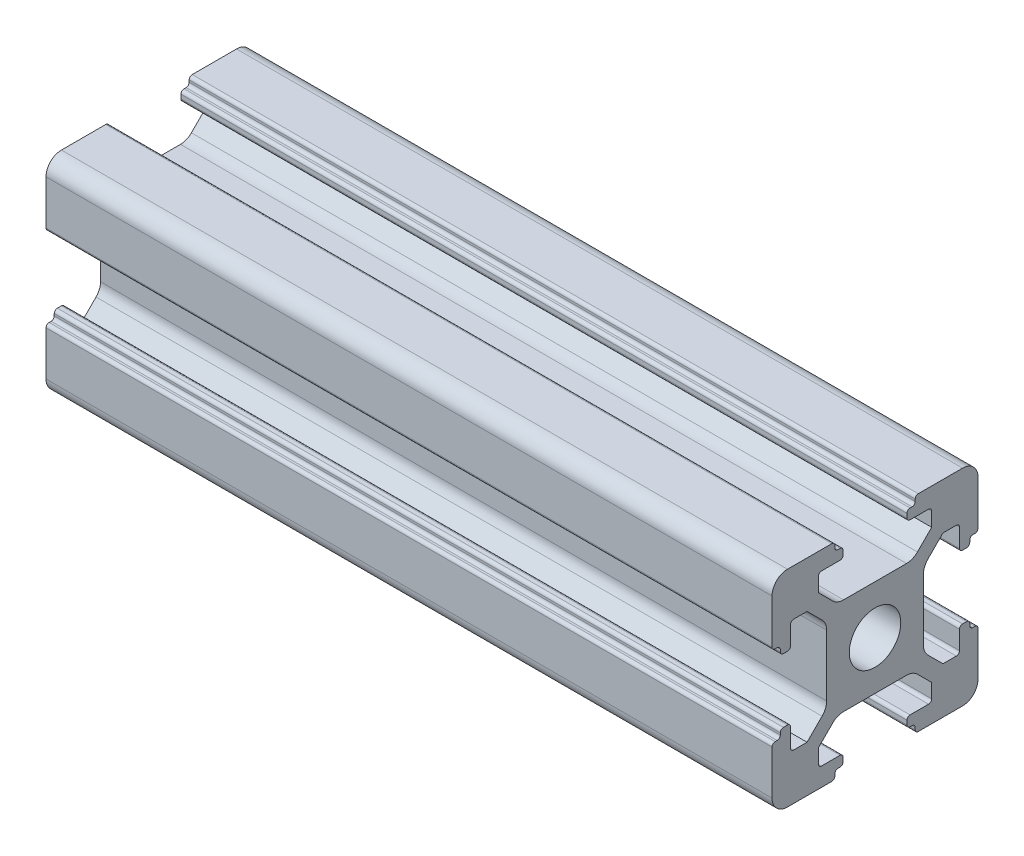
from build123d import *

# Parameters (mm, degrees)
SKETCH1_R           = 2.5
BOSS_EXTRUDE2_DEPTH = 35.25


with BuildPart() as part:
    # Sketch1 → Boss-Extrude2 (new, symmetric)
    with BuildSketch(Plane(origin=(0, 0, 0), x_dir=(0, 0, -1), z_dir=(1, 0, 0))):
        with BuildLine():
            Line((10, 4.2), (10, 8.5))
            ThreePointArc((10, 8.5), (9.560660172, 9.560660172), (8.5, 10))
            Line((8.5, 10), (4.2, 10))
            ThreePointArc((4.2, 10), (3.987867966, 9.912132034), (3.9, 9.7))
            Line((3.9, 9.7), (3.9, 9.5))
            ThreePointArc((3.9, 9.5), (3.812132034, 9.287867966), (3.6, 9.2))
            Line((3.6, 9.2), (3.4, 9.2))
            ThreePointArc((3.4, 9.2), (3.187867966, 9.112132034), (3.1, 8.9))
            Line((3.1, 8.9), (3.1, 8.5))
            ThreePointArc((3.1, 8.5), (3.187867966, 8.287867966), (3.4, 8.2))
            Line((3.4, 8.2), (5.2, 8.2))
            ThreePointArc((5.2, 8.2), (5.412132034, 8.112132034), (5.5, 7.9))
            Line((5.5, 7.9), (5.5, 6.521320344))
            Line((5.5, 6.521320344), (4.118019485, 5.139339828))
            ThreePointArc((4.118019485, 5.139339828), (3.631384461, 4.814180701), (3.057359313, 4.7))
            Line((3.057359313, 4.7), (-3.057359313, 4.7))
            ThreePointArc((-3.057359313, 4.7), (-3.631384461, 4.814180701), (-4.118019485, 5.139339828))
            Line((-4.118019485, 5.139339828), (-5.5, 6.521320344))
            Line((-5.5, 6.521320344), (-5.5, 7.9))
            ThreePointArc((-5.5, 7.9), (-5.412132034, 8.112132034), (-5.2, 8.2))
            Line((-5.2, 8.2), (-3.4, 8.2))
            ThreePointArc((-3.4, 8.2), (-3.187867966, 8.287867966), (-3.1, 8.5))
            Line((-3.1, 8.5), (-3.1, 8.9))
            ThreePointArc((-3.1, 8.9), (-3.187867966, 9.112132034), (-3.4, 9.2))
            Line((-3.4, 9.2), (-3.6, 9.2))
            ThreePointArc((-3.6, 9.2), (-3.812132034, 9.287867966), (-3.9, 9.5))
            Line((-3.9, 9.5), (-3.9, 9.7))
            ThreePointArc((-3.9, 9.7), (-3.987867966, 9.912132034), (-4.2, 10))
            Line((-4.2, 10), (-8.5, 10))
            ThreePointArc((-8.5, 10), (-9.560660172, 9.560660172), (-10, 8.5))
            Line((-10, 8.5), (-10, 4.2))
            ThreePointArc((-10, 4.2), (-9.912132034, 3.987867966), (-9.7, 3.9))
            Line((-9.7, 3.9), (-9.5, 3.9))
            ThreePointArc((-9.5, 3.9), (-9.287867966, 3.812132034), (-9.2, 3.6))
            Line((-9.2, 3.6), (-9.2, 3.4))
            ThreePointArc((-9.2, 3.4), (-9.112132034, 3.187867966), (-8.9, 3.1))
            Line((-8.9, 3.1), (-8.5, 3.1))
            ThreePointArc((-8.5, 3.1), (-8.287867966, 3.187867966), (-8.2, 3.4))
            Line((-8.2, 3.4), (-8.2, 5.2))
            ThreePointArc((-8.2, 5.2), (-8.112132034, 5.412132034), (-7.9, 5.5))
            Line((-7.9, 5.5), (-6.6, 5.5))
            Line((-6.6, 5.5), (-5.139339828, 4.039339828))
            ThreePointArc((-5.139339828, 4.039339828), (-4.814180701, 3.552704805), (-4.7, 2.978679656))
            Line((-4.7, 2.978679656), (-4.7, -2.978679656))
            ThreePointArc((-4.7, -2.978679656), (-4.814180701, -3.552704805), (-5.139339828, -4.039339828))
            Line((-5.139339828, -4.039339828), (-6.6, -5.5))
            Line((-6.6, -5.5), (-7.9, -5.5))
            ThreePointArc((-7.9, -5.5), (-8.112132034, -5.412132034), (-8.2, -5.2))
            Line((-8.2, -5.2), (-8.2, -3.4))
            ThreePointArc((-8.2, -3.4), (-8.287867966, -3.187867966), (-8.5, -3.1))
            Line((-8.5, -3.1), (-8.9, -3.1))
            ThreePointArc((-8.9, -3.1), (-9.112132034, -3.187867966), (-9.2, -3.4))
            Line((-9.2, -3.4), (-9.2, -3.6))
            ThreePointArc((-9.2, -3.6), (-9.287867966, -3.812132034), (-9.5, -3.9))
            Line((-9.5, -3.9), (-9.7, -3.9))
            ThreePointArc((-9.7, -3.9), (-9.912132034, -3.987867966), (-10, -4.2))
            Line((-10, -4.2), (-10, -8.5))
            ThreePointArc((-10, -8.5), (-9.560660172, -9.560660172), (-8.5, -10))
            Line((-8.5, -10), (-4.2, -10))
            ThreePointArc((-4.2, -10), (-3.987867966, -9.912132034), (-3.9, -9.7))
            Line((-3.9, -9.7), (-3.9, -9.5))
            ThreePointArc((-3.9, -9.5), (-3.812132034, -9.287867966), (-3.6, -9.2))
            Line((-3.6, -9.2), (-3.4, -9.2))
            ThreePointArc((-3.4, -9.2), (-3.187867966, -9.112132034), (-3.1, -8.9))
            Line((-3.1, -8.9), (-3.1, -8.5))
            ThreePointArc((-3.1, -8.5), (-3.187867966, -8.287867966), (-3.4, -8.2))
            Line((-3.4, -8.2), (-5.2, -8.2))
            ThreePointArc((-5.2, -8.2), (-5.412132034, -8.112132034), (-5.5, -7.9))
            Line((-5.5, -7.9), (-5.5, -6.521320344))
            Line((-5.5, -6.521320344), (-4.118019485, -5.139339828))
            ThreePointArc((-4.118019485, -5.139339828), (-3.631384461, -4.814180701), (-3.057359313, -4.7))
            Line((-3.057359313, -4.7), (3.057359313, -4.7))
            ThreePointArc((3.057359313, -4.7), (3.631384461, -4.814180701), (4.118019485, -5.139339828))
            Line((4.118019485, -5.139339828), (5.5, -6.521320344))
            Line((5.5, -6.521320344), (5.5, -7.9))
            ThreePointArc((5.5, -7.9), (5.412132034, -8.112132034), (5.2, -8.2))
            Line((5.2, -8.2), (3.4, -8.2))
            ThreePointArc((3.4, -8.2), (3.187867966, -8.287867966), (3.1, -8.5))
            Line((3.1, -8.5), (3.1, -8.9))
            ThreePointArc((3.1, -8.9), (3.187867966, -9.112132034), (3.4, -9.2))
            Line((3.4, -9.2), (3.6, -9.2))
            ThreePointArc((3.6, -9.2), (3.812132034, -9.287867966), (3.9, -9.5))
            Line((3.9, -9.5), (3.9, -9.7))
            ThreePointArc((3.9, -9.7), (3.987867966, -9.912132034), (4.2, -10))
            Line((4.2, -10), (8.5, -10))
            ThreePointArc((8.5, -10), (9.560660172, -9.560660172), (10, -8.5))
            Line((10, -8.5), (10, -4.2))
            ThreePointArc((10, -4.2), (9.912132034, -3.987867966), (9.7, -3.9))
            Line((9.7, -3.9), (9.5, -3.9))
            ThreePointArc((9.5, -3.9), (9.287867966, -3.812132034), (9.2, -3.6))
            Line((9.2, -3.6), (9.2, -3.4))
            ThreePointArc((9.2, -3.4), (9.112132034, -3.187867966), (8.9, -3.1))
            Line((8.9, -3.1), (8.5, -3.1))
            ThreePointArc((8.5, -3.1), (8.287867966, -3.187867966), (8.2, -3.4))
            Line((8.2, -3.4), (8.2, -5.2))
            ThreePointArc((8.2, -5.2), (8.112132034, -5.412132034), (7.9, -5.5))
            Line((7.9, -5.5), (6.6, -5.5))
            Line((6.6, -5.5), (5.139339828, -4.039339828))
            ThreePointArc((5.139339828, -4.039339828), (4.814180701, -3.552704805), (4.7, -2.978679656))
            Line((4.7, -2.978679656), (4.7, 2.978679656))
            ThreePointArc((4.7, 2.978679656), (4.814180701, 3.552704805), (5.139339828, 4.039339828))
            Line((5.139339828, 4.039339828), (6.6, 5.5))
            Line((6.6, 5.5), (7.9, 5.5))
            ThreePointArc((7.9, 5.5), (8.112132034, 5.412132034), (8.2, 5.2))
            Line((8.2, 5.2), (8.2, 3.4))
            ThreePointArc((8.2, 3.4), (8.287867966, 3.187867966), (8.5, 3.1))
            Line((8.5, 3.1), (8.9, 3.1))
            ThreePointArc((8.9, 3.1), (9.112132034, 3.187867966), (9.2, 3.4))
            Line((9.2, 3.4), (9.2, 3.6))
            ThreePointArc((9.2, 3.6), (9.287867966, 3.812132034), (9.5, 3.9))
            Line((9.5, 3.9), (9.7, 3.9))
            ThreePointArc((9.7, 3.9), (9.912132034, 3.987867966), (10, 4.2))
        make_face()
        Circle(SKETCH1_R, mode=Mode.SUBTRACT)
    extrude(amount=BOSS_EXTRUDE2_DEPTH, both=True)


solid = part.part
